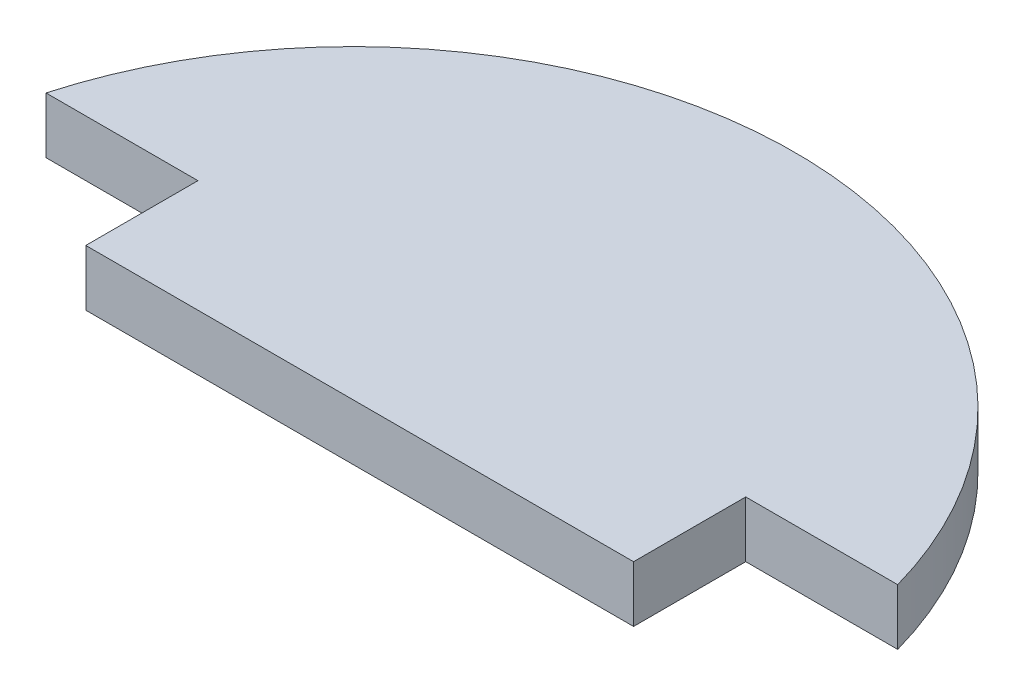
from build123d import *

# Parameters (mm, degrees)
BOSS_EXTRUDE1_DEPTH = 5


with BuildPart() as part:
    # Sketch1 → Boss-Extrude1 (new body)
    with BuildSketch(Plane(origin=(0, 0, 0), x_dir=(1, 0, 0), z_dir=(0, 1, 0))):
        with BuildLine():
            ThreePointArc((-40.530858986, 10), (-2.570543478, 38.792166423), (35.38977203, 10))
            Line((35.38977203, 10), (21.844456522, 10))
            Line((21.844456522, 10), (21.844456522, 0))
            Line((21.844456522, 0), (-26.985543478, 0))
            Line((-26.985543478, 0), (-26.985543478, 10))
            Line((-26.985543478, 10), (-40.530858986, 10))
        make_face()
    extrude(amount=BOSS_EXTRUDE1_DEPTH)


solid = part.part
